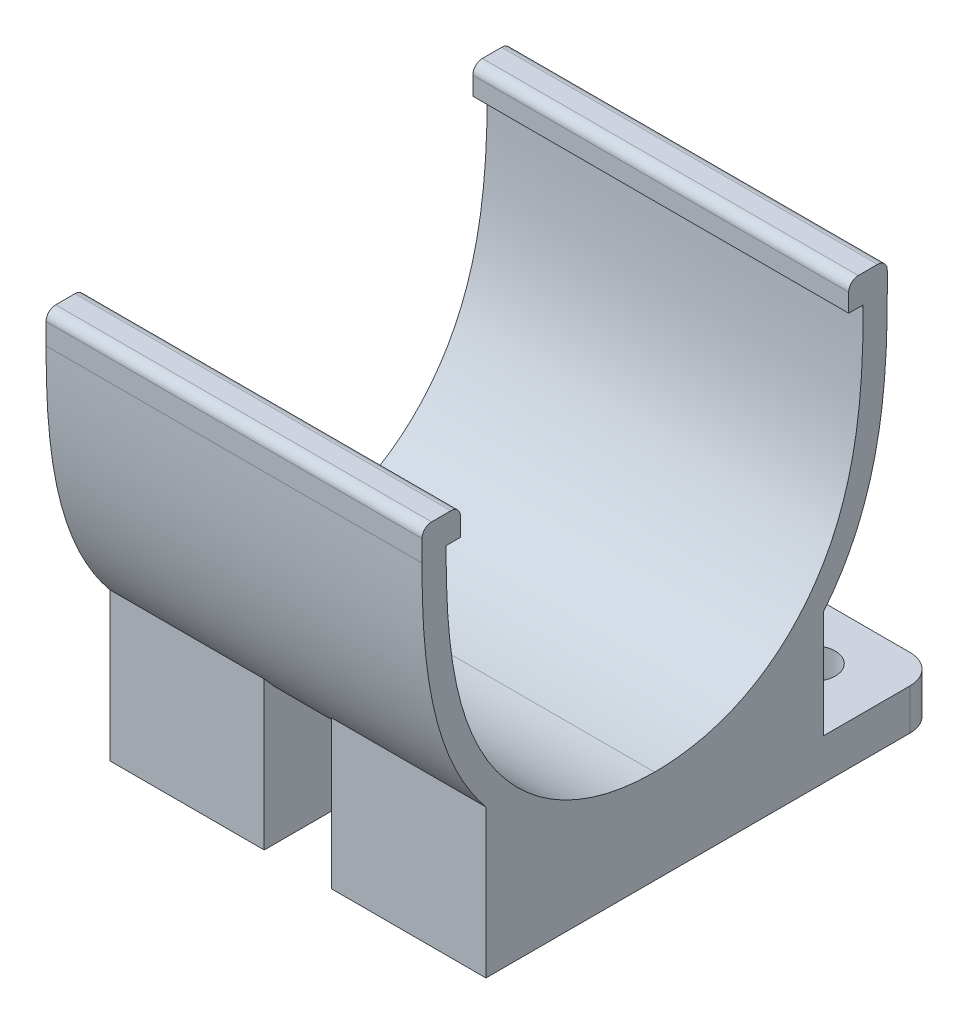
from build123d import *

# Parameters (mm, degrees)
BOSS_EXTRUDE1_DEPTH       = 19.5
BOSS_EXTRUDE2_DEPTH       = 39
CUT_EXTRUDE3_DEPTH        = 3.5
CUT_EXTRUDE4_DEPTH        = 55.290429568
FILLET3_R                 = 1
SKETCH17_W                = 16
SKETCH17_H                = 12
BOSS_EXTRUDE5_DEPTH       = 5
F_8_CLEARANCE_HOLE3_D     = 4.4958
F_8_CLEARANCE_HOLE3_DEPTH = 5.000025
FILLET4_R                 = 3
CHAMFER3_SIZE             = 0.75


with BuildPart() as part:
    # Sketch1 → Boss-Extrude1 (new, symmetric)
    with BuildSketch(Plane(origin=(0, 0, 0), x_dir=(0, 0, -1), z_dir=(1, 0, 0))):
        with BuildLine():
            Line((24.135, -1.19), (24.135, 2))
            Line((24.135, 2), (20.135, 2))
            Line((20.135, 2), (20.135, -0.89))
            Line((20.135, -0.89), (21.635, -0.89))
            Line((21.635, -0.89), (21.635, -1.19))
            add(Edge.make_bspline(
                [(21.635, -1.19), (21.635, -1.998462676), (21.622680551, -3.592014532), (21.510096247, -6.965209866), (21.130375225, -11.301119131), (20.060433065, -16.48406934), (18.116145963, -21.382074575), (15.118711368, -25.707626918), (11.777711797, -28.59337759), (8.606762697, -30.324077361), (5.986754657, -31.296281996), (3.601468567, -31.805145363), (1.586664566, -32.014234184), (0.524632806, -32.05), (0, -32.05)],
                knots=[0, 0, 0, 0, 0.0625, 0.125, 0.25, 0.375, 0.5, 0.625, 0.75, 0.8125, 0.875, 0.9375, 0.96875, 1, 1, 1, 1], degree=3))
            add(Edge.make_bspline(
                [(0, -32.05), (-0.524632806, -32.05), (-1.586664566, -32.014234184), (-3.601468567, -31.805145363), (-5.986754657, -31.296281996), (-8.606762697, -30.324077361), (-11.777711797, -28.59337759), (-15.118711368, -25.707626918), (-18.116145963, -21.382074575), (-20.060433065, -16.48406934), (-21.130375225, -11.301119131), (-21.510096247, -6.965209866), (-21.622680551, -3.592014532), (-21.635, -1.998462676), (-21.635, -1.19)],
                knots=[0, 0, 0, 0, 0.03125, 0.0625, 0.125, 0.1875, 0.25, 0.375, 0.5, 0.625, 0.75, 0.875, 0.9375, 1, 1, 1, 1], degree=3))
            Line((-21.635, -1.19), (-21.635, -0.89))
            Line((-21.635, -0.89), (-20.135, -0.89))
            Line((-20.135, -0.89), (-20.135, 2))
            Line((-20.135, 2), (-24.135, 2))
            Line((-24.135, 2), (-24.135, -1.19))
            add(Edge.make_bspline(
                [(0, -34.55), (-0.581310806, -34.55), (-1.755598946, -34.510482709), (-4.00292596, -34.277644235), (-6.682236507, -33.706779298), (-9.644943363, -32.607998263), (-13.237385134, -30.647242284), (-17.006683041, -27.387507945), (-20.343867001, -22.563681145), (-22.476754921, -17.174175127), (-23.422185467, -12.568650897), (-23.848958822, -8.925657265), (-24.035561365, -6.245067567), (-24.108030812, -4.082618687), (-24.131873053, -2.404041328), (-24.135, -1.59740537), (-24.135, -1.19)],
                knots=[0, 0, 0, 0, 0.03125, 0.0625, 0.125, 0.1875, 0.25, 0.375, 0.5, 0.625, 0.75, 0.8125, 0.875, 0.9375, 0.96875, 1, 1, 1, 1], degree=3))
            add(Edge.make_bspline(
                [(24.135, -1.19), (24.135, -1.59740537), (24.131873053, -2.404041328), (24.108030812, -4.082618687), (24.035561365, -6.245067567), (23.848958822, -8.925657265), (23.422185467, -12.568650897), (22.476754921, -17.174175127), (20.343867001, -22.563681145), (17.006683041, -27.387507945), (13.237385134, -30.647242284), (9.644943363, -32.607998263), (6.682236507, -33.706779298), (4.00292596, -34.277644235), (1.755598946, -34.510482709), (0.581310806, -34.55), (0, -34.55)],
                knots=[0, 0, 0, 0, 0.03125, 0.0625, 0.125, 0.1875, 0.25, 0.375, 0.5, 0.625, 0.75, 0.8125, 0.875, 0.9375, 0.96875, 1, 1, 1, 1], degree=3))
        make_face()
    extrude(amount=BOSS_EXTRUDE1_DEPTH, both=True)

    # Sketch4 → Boss-Extrude2 (add)
    with BuildSketch(Plane(origin=(19.5, 0, 0), x_dir=(0, 0, -1), z_dir=(1, 0, 0))):
        with BuildLine():
            Line((-17.5, -26.431462607), (-17.5, -42.55))
            Line((-17.5, -42.55), (17.5, -42.55))
            Line((17.5, -42.55), (17.5, -26.431462607))
            add(Edge.make_bspline(
                [(0, -34.55), (0.581310806, -34.55), (1.755598946, -34.510482709), (4.00292596, -34.277644235), (6.682236507, -33.706779298), (9.644943363, -32.607998263), (13.237385134, -30.647242284), (15.771480911, -28.45572566), (17.276143202, -26.704208912), (17.5, -26.431462607)],
                knots=[0, 0, 0, 0, 0.03125, 0.0625, 0.125, 0.1875, 0.25, 0.375, 0.397593484, 0.397593484, 0.397593484, 0.397593484], degree=3))
            add(Edge.make_bspline(
                [(-17.5, -26.431462607), (-17.276143202, -26.704208912), (-15.771480911, -28.45572566), (-13.237385134, -30.647242284), (-9.644943363, -32.607998263), (-6.682236507, -33.706779298), (-4.00292596, -34.277644235), (-1.755598946, -34.510482709), (-0.581310806, -34.55), (0, -34.55)],
                knots=[0.602406516, 0.602406516, 0.602406516, 0.602406516, 0.625, 0.75, 0.8125, 0.875, 0.9375, 0.96875, 1, 1, 1, 1], degree=3))
        make_face()
    extrude(amount=-BOSS_EXTRUDE2_DEPTH)

    # Sketch14 → Cut-Extrude3 (cut, symmetric)
    with BuildSketch(Plane(origin=(0, 0, 0), x_dir=(0, 0, -1), z_dir=(1, 0, 0))):
        with BuildLine():
            Line((-17.5, -42.55), (-17.5, -26.431462607))
            add(Edge.make_bspline(
                [(0, -34.55), (-0.581310806, -34.55), (-1.755598946, -34.510482709), (-4.00292596, -34.277644235), (-6.682236507, -33.706779298), (-9.644943363, -32.607998263), (-13.237385134, -30.647242284), (-15.771480911, -28.45572566), (-17.276143202, -26.704208912), (-17.5, -26.431462607)],
                knots=[0, 0, 0, 0, 0.03125, 0.0625, 0.125, 0.1875, 0.25, 0.375, 0.397593484, 0.397593484, 0.397593484, 0.397593484], degree=3))
            add(Edge.make_bspline(
                [(17.5, -26.431462607), (17.276143202, -26.704208912), (15.771480911, -28.45572566), (13.237385134, -30.647242284), (9.644943363, -32.607998263), (6.682236507, -33.706779298), (4.00292596, -34.277644235), (1.755598946, -34.510482709), (0.581310806, -34.55), (0, -34.55)],
                knots=[0.602406516, 0.602406516, 0.602406516, 0.602406516, 0.625, 0.75, 0.8125, 0.875, 0.9375, 0.96875, 1, 1, 1, 1], degree=3))
            Line((17.5, -26.431462607), (17.5, -42.55))
            Line((17.5, -42.55), (-17.5, -42.55))
        make_face()
    extrude(amount=CUT_EXTRUDE3_DEPTH, both=True, mode=Mode.SUBTRACT)

    # Sketch15 → Cut-Extrude4 (cut, through all)
    with BuildSketch(Plane.XZ.offset(42.55)):
        with BuildLine():
            Line((-19.5, 14.67), (-11.775, 14.67))
            ThreePointArc((-11.775, 14.67), (-6.775, 9.67), (-11.775, 4.67))
            Line((-11.775, 4.67), (-19.5, 4.67))
            Line((-19.5, 4.67), (-19.5, 14.67))
        make_face()
    extrude(amount=-CUT_EXTRUDE4_DEPTH, mode=Mode.SUBTRACT)

    # Fillet3
    fillet3_edges = [part.edges().sort_by_distance(p)[0] for p in [
        (0, 2, -20.135),
        (0, 2, -24.135),
        (0, 2, 24.135),
        (0, 2, 20.135),
    ]]
    fillet(fillet3_edges, radius=FILLET3_R)

    # Sketch17 → Boss-Extrude5 (add)
    with BuildSketch(Plane.XZ.offset(42.55)):
        with Locations((-11.5, -23.5)):
            Rectangle(SKETCH17_W, SKETCH17_H)
        with Locations((11.5, -23.5)):
            Rectangle(SKETCH17_W, SKETCH17_H)
    extrude(amount=-BOSS_EXTRUDE5_DEPTH)

    # #8 Clearance Hole3
    with Locations(Plane(origin=(0, -37.55, 0), x_dir=(1, 0, 0), z_dir=(0, 1, 0))):
        with Locations((-12.5, 23.5), (12.5, 23.5)):
            Hole(F_8_CLEARANCE_HOLE3_D / 2, depth=F_8_CLEARANCE_HOLE3_DEPTH)

    # Fillet4
    fillet4_edges = [part.edges().sort_by_distance(p)[0] for p in [
        (-3.5, -40.05, -29.5),
        (-19.5, -40.05, -29.5),
        (3.5, -40.05, -29.5),
        (19.5, -40.05, -29.5),
    ]]
    fillet(fillet4_edges, radius=FILLET4_R)

    # Chamfer3
    chamfer3_edges = [part.edges().sort_by_distance(p)[0] for p in [
        (14.7479, -42.55, -23.5),
        (-10.2521, -42.55, -23.5),
        (11.5, -42.55, -29.5),
        (4.378679656, -42.55, -28.621320344),
        (18.621320344, -42.55, -28.621320344),
        (-11.5, -42.55, -29.5),
        (-19.5, -42.55, -10.915),
        (-18.621320344, -42.55, -28.621320344),
        (-4.378679656, -42.55, -28.621320344),
        (-11.5, -42.55, 17.5),
        (19.5, -42.55, -4.5),
        (11.5, -42.55, 17.5),
        (-3.5, -42.55, -4.5),
        (3.5, -42.55, -4.5),
        (-19.5, -42.55, 16.085),
        (-15.6375, -42.55, 4.67),
        (-6.775, -42.55, 9.67),
        (-15.6375, -42.55, 14.67),
    ]]
    chamfer(chamfer3_edges, length=CHAMFER3_SIZE)


solid = part.part
